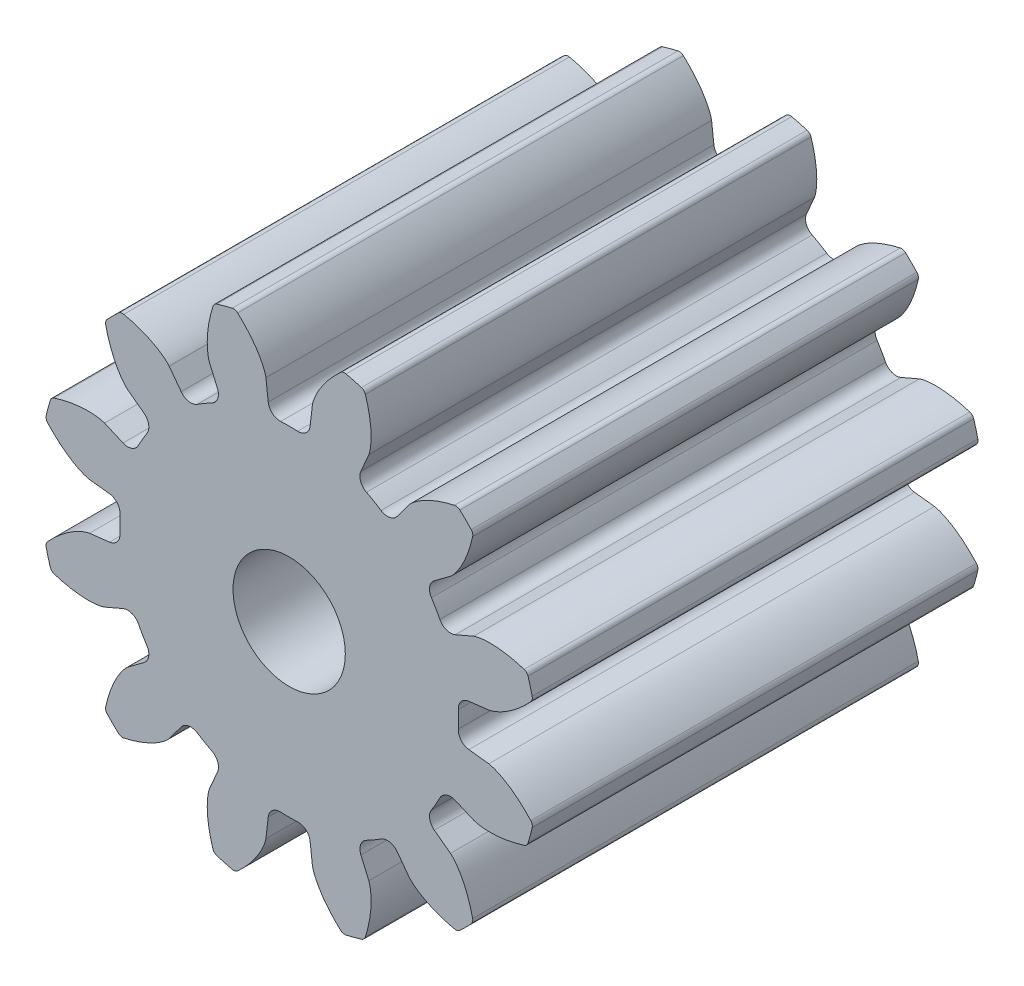
from build123d import *

# Parameters (mm, degrees)
SKETCH1_R                                 = 7.112
BOSS_EXTRUDE1_DEPTH                       = 12.7
CUT_EXTRUDE_DCLTBC_DEPTH                  = 17.200342219
FILLET_TIP_DCLTBC_R                       = 0.170436558
FILLET_ROOT_DCLTBC_R                      = 0.340873116
CIRPATTERN_DCLTBC_COUNT                   = 12
FILLET_TIP_DCLTBC_OF_CIRPATTERN_DCLTBC_R  = 0.170436558
FILLET_ROOT_DCLTBC_OF_CIRPATTERN_DCLTBC_R = 0.340873116
SKETCH4_W                                 = 3.8338
SKETCH4_H                                 = 3.993099664
CUT_EXTRUDE1_DEPTH                        = 17.041149826
SKETCH6_R                                 = 1.6
BOSS_EXTRUDE2_DEPTH                       = 4.826
CHAMFER1_SIZE                             = 0.508


with BuildPart() as part:
    # Sketch1 → Boss-Extrude1 (new body)
    with BuildSketch(Plane.XY):
        Circle(SKETCH1_R)
    extrude(amount=BOSS_EXTRUDE1_DEPTH)

    # DCLTBC → Cut-Extrude-DCLTBC (cut, through all)
    with BuildSketch(Plane.XY):
        with BuildLine():
            Line((-0.662974567, 5.689872075), (-0.558538882, 4.793569684))
            ThreePointArc((-0.558538882, 4.793569684), (0, 4.826), (0.558538882, 4.793569684))
            Line((0.558538882, 4.793569684), (0.662974567, 5.689872075))
            add(Edge.make_bspline(
                [(0.662974567, 5.689872075), (0.663275397, 5.692145464), (0.664228697, 5.698506862), (0.666463146, 5.710471636), (0.670720167, 5.729889389), (0.677039415, 5.754461613), (0.686229455, 5.786001566), (0.698363916, 5.822849076), (0.713061744, 5.862991037), (0.730512439, 5.906252019), (0.749205224, 5.949022812), (0.769037864, 5.991304795), (0.789858477, 6.033063367), (0.81632592, 6.083195998), (0.849790681, 6.142668259), (0.891392381, 6.211185136), (0.941487387, 6.287669165), (0.995607559, 6.364224937), (1.051365877, 6.438382008), (1.110528205, 6.511878211), (1.169770874, 6.581970613), (1.234132655, 6.653215412), (1.294986248, 6.718191166), (1.366224175, 6.789174393), (1.424614, 6.845936255), (1.48743381, 6.90300279), (1.518375469, 6.930543324), (1.534342146, 6.944518571)],
                knots=[0, 0, 0, 0, 0, 0.005376749, 0.015083688, 0.02853182, 0.046610139, 0.064854849, 0.092110525, 0.119476176, 0.146842496, 0.174208854, 0.201574956, 0.228941013, 0.256307345, 0.307035032, 0.361767352, 0.416499661, 0.471231937, 0.525964282, 0.580696615, 0.635428982, 0.690161387, 0.744893688, 0.799626082, 0.854358408, 0.909090915, 0.909090915, 0.909090915, 0.909090915, 0.909090915], degree=4))
            ThreePointArc((1.534342146, 6.944518571), (0, 7.112), (-1.534342146, 6.944518571))
            add(Edge.make_bspline(
                [(-0.662974567, 5.689872075), (-0.663275397, 5.692145464), (-0.664228697, 5.698506862), (-0.666463146, 5.710471636), (-0.670720167, 5.729889389), (-0.677039415, 5.754461613), (-0.686229455, 5.786001566), (-0.698363916, 5.822849076), (-0.713061744, 5.862991037), (-0.730512439, 5.906252019), (-0.749205224, 5.949022812), (-0.769037864, 5.991304795), (-0.789858477, 6.033063367), (-0.81632592, 6.083195998), (-0.849790681, 6.142668259), (-0.891392381, 6.211185136), (-0.941487387, 6.287669165), (-0.995607559, 6.364224937), (-1.051365877, 6.438382008), (-1.110528205, 6.511878211), (-1.169770874, 6.581970613), (-1.234132655, 6.653215412), (-1.294986248, 6.718191166), (-1.366224175, 6.789174393), (-1.424614, 6.845936255), (-1.48743381, 6.90300279), (-1.518375469, 6.930543324), (-1.534342146, 6.944518571)],
                knots=[0, 0, 0, 0, 0, 0.005376749, 0.015083688, 0.02853182, 0.046610139, 0.064854849, 0.092110525, 0.119476176, 0.146842496, 0.174208854, 0.201574956, 0.228941013, 0.256307345, 0.307035032, 0.361767352, 0.416499661, 0.471231937, 0.525964282, 0.580696615, 0.635428982, 0.690161387, 0.744893688, 0.799626082, 0.854358408, 0.909090915, 0.909090915, 0.909090915, 0.909090915, 0.909090915], degree=4))
        make_face()
    cut_extrude_dcltbc = extrude(amount=CUT_EXTRUDE_DCLTBC_DEPTH, mode=Mode.SUBTRACT)

    # Fillet-Tip-DCLTBC
    fillet_tip_dcltbc_edges = [part.edges().sort_by_distance(p)[0] for p in [
        (1.534342146, 6.944518571, 6.35),
        (-1.534342146, 6.944518571, 6.35),
    ]]
    fillet(fillet_tip_dcltbc_edges, radius=FILLET_TIP_DCLTBC_R)

    # Fillet-Root-DCLTBC
    fillet_root_dcltbc_edges = [part.edges().sort_by_distance(p)[0] for p in [
        (0.558538882, 4.793569684, 6.35),
        (-0.558538882, 4.793569684, 6.35),
    ]]
    fillet(fillet_root_dcltbc_edges, radius=FILLET_ROOT_DCLTBC_R)

    # CirPattern-DCLTBC: Cut-Extrude-DCLTBC ×12 about axis
    cirpattern_dcltbc_axis = Axis((0, 0, 12.7), (0, 0, 1))
    for i in range(1, CIRPATTERN_DCLTBC_COUNT):
        add(cut_extrude_dcltbc.rotate(cirpattern_dcltbc_axis, i * 360 / CIRPATTERN_DCLTBC_COUNT), mode=Mode.SUBTRACT)

    # Fillet-Tip-DCLTBC of CirPattern-DCLTBC
    fillet_tip_dcltbc_of_cirpattern_dcltbc_edges = [part.edges().sort_by_distance(p)[0] for p in [
        (-2.143480009, 6.781300572, 6.35),
        (-4.801038562, 5.246958426, 6.35),
        (-5.246958426, 4.801038562, 6.35),
        (-6.781300572, 2.143480009, 6.35),
        (-6.944518571, 1.534342146, 6.35),
        (-6.944518571, -1.534342146, 6.35),
        (-6.781300572, -2.143480009, 6.35),
        (-5.246958426, -4.801038562, 6.35),
        (-4.801038562, -5.246958426, 6.35),
        (-2.143480009, -6.781300572, 6.35),
        (-1.534342146, -6.944518571, 6.35),
        (1.534342146, -6.944518571, 6.35),
        (2.143480009, -6.781300572, 6.35),
        (4.801038562, -5.246958426, 6.35),
        (5.246958426, -4.801038562, 6.35),
        (6.781300572, -2.143480009, 6.35),
        (6.944518571, -1.534342146, 6.35),
        (6.944518571, 1.534342146, 6.35),
        (6.781300572, 2.143480009, 6.35),
        (5.246958426, 4.801038562, 6.35),
        (4.801038562, 5.246958426, 6.35),
        (2.143480009, 6.781300572, 6.35),
    ]]
    fillet(fillet_tip_dcltbc_of_cirpattern_dcltbc_edges, radius=FILLET_TIP_DCLTBC_OF_CIRPATTERN_DCLTBC_R)

    # Fillet-Root-DCLTBC of CirPattern-DCLTBC
    fillet_root_dcltbc_of_cirpattern_dcltbc_edges = [part.edges().sort_by_distance(p)[0] for p in [
        (-1.913075981, 4.430622562, 6.35),
        (-2.880493703, 3.87208368, 6.35),
        (-3.87208368, 2.880493703, 6.35),
        (-4.430622562, 1.913075981, 6.35),
        (-4.793569684, 0.558538882, 6.35),
        (-4.793569684, -0.558538882, 6.35),
        (-4.430622562, -1.913075981, 6.35),
        (-3.87208368, -2.880493703, 6.35),
        (-2.880493703, -3.87208368, 6.35),
        (-1.913075981, -4.430622562, 6.35),
        (-0.558538882, -4.793569684, 6.35),
        (0.558538882, -4.793569684, 6.35),
        (1.913075981, -4.430622562, 6.35),
        (2.880493703, -3.87208368, 6.35),
        (3.87208368, -2.880493703, 6.35),
        (4.430622562, -1.913075981, 6.35),
        (4.793569684, -0.558538882, 6.35),
        (4.793569684, 0.558538882, 6.35),
        (4.430622562, 1.913075981, 6.35),
        (3.87208368, 2.880493703, 6.35),
        (2.880493703, 3.87208368, 6.35),
        (1.913075981, 4.430622562, 6.35),
    ]]
    fillet(fillet_root_dcltbc_of_cirpattern_dcltbc_edges, radius=FILLET_ROOT_DCLTBC_OF_CIRPATTERN_DCLTBC_R)

    # Sketch4 → Cut-Extrude1 (cut, through all)
    with BuildSketch(Plane.XY.offset(12.7)):
        Rectangle(SKETCH4_W, SKETCH4_H)
        with BuildLine():
            Line((1.9169, -1.996549832), (-1.9169, -1.996549832))
            ThreePointArc((-1.9169, -1.996549832), (0, -2.7678), (1.9169, -1.996549832))
        make_face()
        with BuildLine():
            ThreePointArc((1.9169, 1.996549832), (0, 2.7678), (-1.9169, 1.996549832))
            Line((-1.9169, 1.996549832), (1.9169, 1.996549832))
        make_face()
    extrude(amount=-CUT_EXTRUDE1_DEPTH, mode=Mode.SUBTRACT)

    # Sketch6 → Boss-Extrude2 (add)
    with BuildSketch(Plane.XY.offset(12.7)):
        with BuildLine():
            Line((1.9169, 1.996549832), (1.9169, -1.996549832))
            ThreePointArc((1.9169, -1.996549832), (0, -2.7678), (-1.9169, -1.996549832))
            Line((-1.9169, -1.996549832), (-1.9169, 1.996549832))
            ThreePointArc((-1.9169, 1.996549832), (0, 2.7678), (1.9169, 1.996549832))
        make_face()
        Circle(SKETCH6_R, mode=Mode.SUBTRACT)
    extrude(amount=-BOSS_EXTRUDE2_DEPTH)

    # Chamfer1
    chamfer1_edges = [part.edges().sort_by_distance(p)[0] for p in [
        (0, -2.7678, 0),
        (-1.9169, 0, 0),
        (0, 2.7678, 0),
        (1.9169, 0, 0),
    ]]
    chamfer(chamfer1_edges, length=CHAMFER1_SIZE)


solid = part.part
